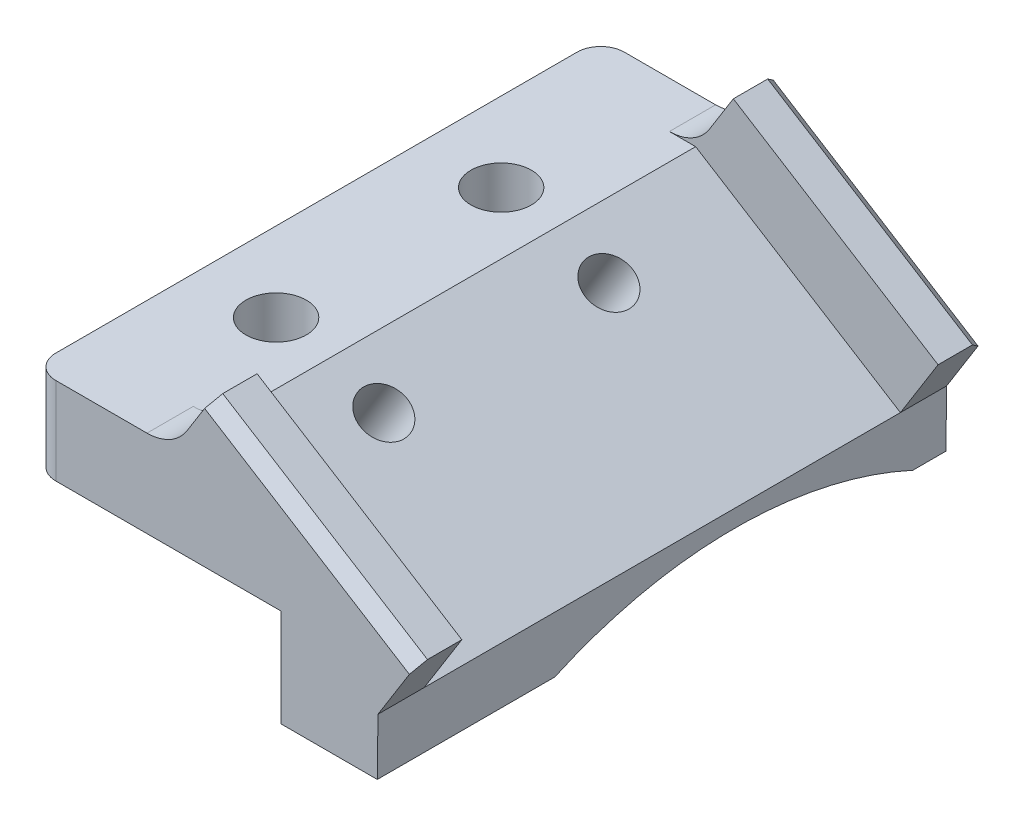
from build123d import *

# Parameters (mm, degrees)
BOSS_EXTRUDE1_DEPTH = 24
SKETCH3_W           = 10.19023154
SKETCH3_H           = 1.95
BOSS_EXTRUDE2_DEPTH = 3
SKETCH5_R           = 18
CUT_EXTRUDE1_DEPTH  = 30.921809562
CHAMFER1_SIZE       = 0.5
FILLET1_R           = 1
SKETCH6_R           = 1.275
CUT_EXTRUDE2_DEPTH  = 30.14023621
SKETCH7_R           = 1
CUT_EXTRUDE3_DEPTH  = 31.169687207
FILLET2_R           = 2


with BuildPart() as part:
    # Sketch2 → Boss-Extrude1 (new body)
    with BuildSketch(Plane.XY):
        Polygon((-14.57097685, 4.125), (-4.07097685, 4.125), (-4.07097685, 0), (0, 0), (0.02932299, 2.4), (-8.612483466, 7.8), (-14.57097685, 7.8), align=None)
    extrude(amount=BOSS_EXTRUDE1_DEPTH)

    # Sketch3 → Boss-Extrude2 (add)
    with BuildSketch(Plane(origin=(1.086787174, 1.739223041, 0), x_dir=(0.8480480961564272, -0.5299192642332031, 0), z_dir=(0.5299192642332031, 0.8480480961564273, 0))):
        with Locations((-6.342054698, -0.975)):
            Rectangle(SKETCH3_W, SKETCH3_H)
        with Locations((-6.342054698, -23.025)):
            Rectangle(SKETCH3_W, SKETCH3_H)
    extrude(amount=BOSS_EXTRUDE2_DEPTH)

    # Sketch5 → Cut-Extrude1 (cut, through all)
    with BuildSketch(Plane(origin=(0, 0, 0), x_dir=(0, 0, -1), z_dir=(0.9999253696604522, -0.012217000835240004, 0))):
        with Locations((-8.95, -16.33799405)):
            Circle(SKETCH5_R)
    extrude(amount=-CUT_EXTRUDE1_DEPTH, mode=Mode.SUBTRACT)

    # Chamfer1
    chamfer1_edges = [part.edges().sort_by_distance(p)[0] for p in [
        (-2.701822445, 7.644144288, 0),
        (-2.701822445, 7.644144288, 24),
    ]]
    chamfer(chamfer1_edges, length=CHAMFER1_SIZE)

    # Fillet1
    fillet1_edges = [part.edges().sort_by_distance(p)[0] for p in [
        (-14.57097685, 5.9625, 24),
        (-14.57097685, 5.9625, 0),
    ]]
    fillet(fillet1_edges, radius=FILLET1_R)

    # Sketch6 → Cut-Extrude2 (cut, through all)
    with BuildSketch(Plane(origin=(0, 7.8, 0), x_dir=(1, 0, 0), z_dir=(0, 1, 0))):
        with Locations(Location((-11.22097685, -17.05, 0), (0, 0, 180))):
            Circle(SKETCH6_R)
        with Locations(Location((-11.22097685, -7.55, 0), (0, 0, 180))):
            Circle(SKETCH6_R)
    extrude(amount=-CUT_EXTRUDE2_DEPTH, mode=Mode.SUBTRACT)

    # Sketch7 → Cut-Extrude3 (cut, through all)
    with BuildSketch(Plane(origin=(2.676544967, 4.283367329, 0), x_dir=(0.8480480961564271, -0.5299192642332031, 0), z_dir=(0.5299192642332031, 0.8480480961564271, 0))):
        with Locations((-9.151078225, -17.05)):
            Circle(SKETCH7_R)
        with Locations((-9.151078225, -7.55)):
            Circle(SKETCH7_R)
    extrude(amount=-CUT_EXTRUDE3_DEPTH, mode=Mode.SUBTRACT)

    # Fillet2
    fillet2_edges = [part.edges().sort_by_distance(p)[0] for p in [
        (-8.612483466, 7.8, 23.025),
        (-8.612483466, 7.8, 0.975),
    ]]
    fillet(fillet2_edges, radius=FILLET2_R)


solid = part.part
